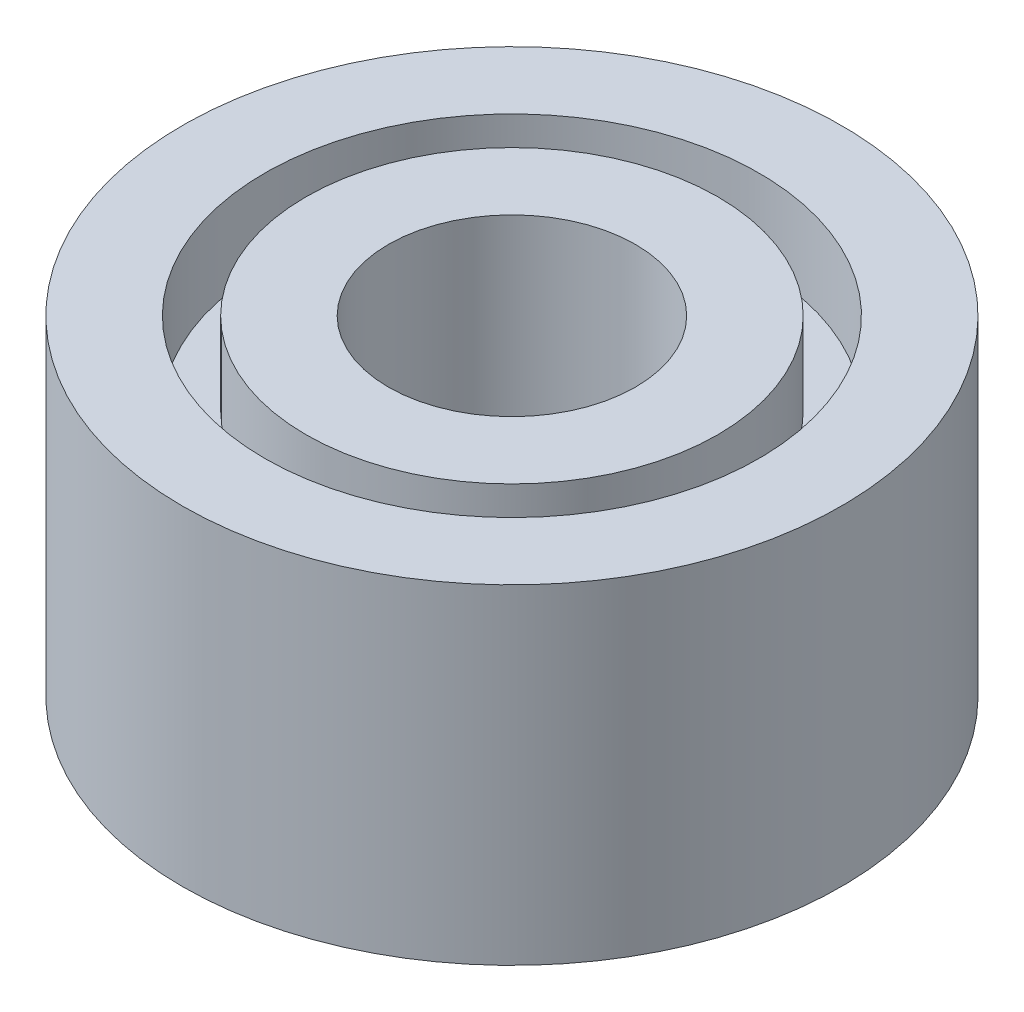
from build123d import *

# Parameters (mm, degrees)
SKETCH_1_R          = 4
SKETCH_1_R_2        = 1.5
EXTRUDE_1_DEPTH     = 4
SKETCH_2_R          = 3
SKETCH_2_R_2        = 2.5
CUT_EXTRUDE_2_DEPTH = 1


with BuildPart() as part:
    # 草图1 → 凸台-拉伸1 (new body)
    with BuildSketch(Plane(origin=(0, 0, 0), x_dir=(1, 0, 0), z_dir=(0, 1, 0))):
        with Locations(Location((0, 0, 0), (0, 0, 270))):
            Circle(SKETCH_1_R)
        with Locations(Location((0, 0, 0), (0, 0, 270))):
            Circle(SKETCH_1_R_2, mode=Mode.SUBTRACT)
    extrude(amount=EXTRUDE_1_DEPTH)

    # 草图2 → 切除-拉伸2 (cut)
    with BuildSketch(Plane(origin=(0, 4, 0), x_dir=(1, 0, 0), z_dir=(0, 1, 0))):
        with Locations(Location((0, 0, 0), (0, 0, 270))):
            Circle(SKETCH_2_R)
        with Locations(Location((0, 0, 0), (0, 0, 270))):
            Circle(SKETCH_2_R_2, mode=Mode.SUBTRACT)
    cut_extrude_2 = extrude(amount=-CUT_EXTRUDE_2_DEPTH, mode=Mode.SUBTRACT)

    # 镜向1: 切除-拉伸2 across plane
    add(cut_extrude_2.mirror(Plane.ZX.offset(2)), mode=Mode.SUBTRACT)


solid = part.part
